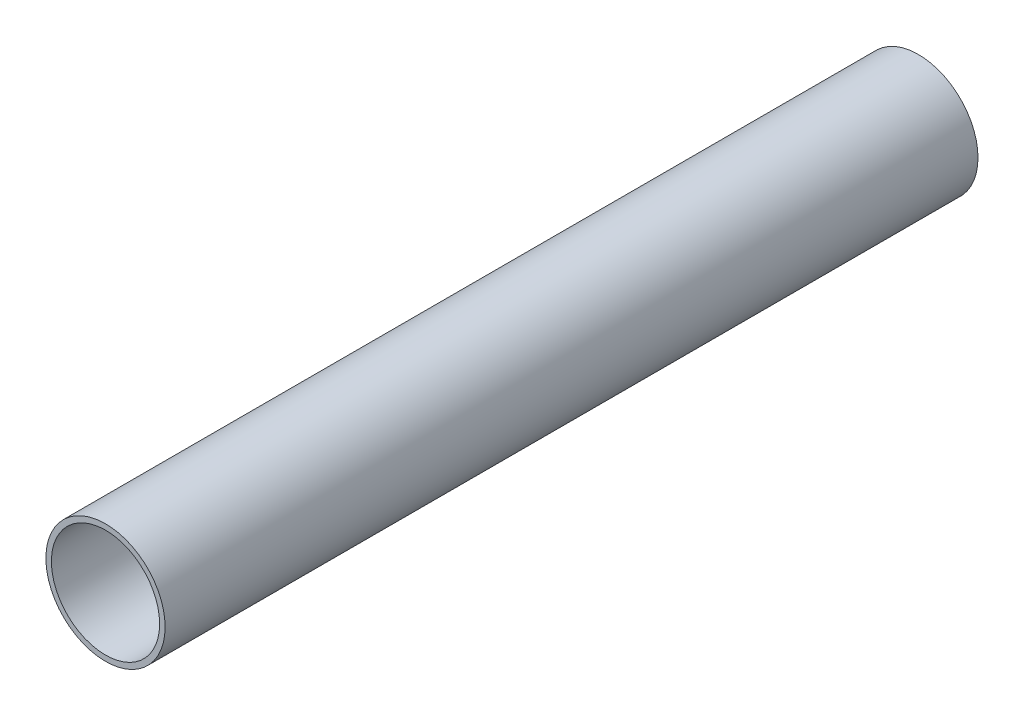
from build123d import *

# Parameters (mm, degrees)
SKETCH1_R        = 55
SKETCH1_R_2      = 49.92
EXTRUSION1_DEPTH = 750


with BuildPart() as part:
    # Sketch1 → Extrusion1 (new body)
    with BuildSketch(Plane.XY):
        with Locations((0.140137906, 0)):
            Circle(SKETCH1_R)
        with Locations((0.140137906, 0)):
            Circle(SKETCH1_R_2, mode=Mode.SUBTRACT)
    extrude(amount=EXTRUSION1_DEPTH)


solid = part.part
